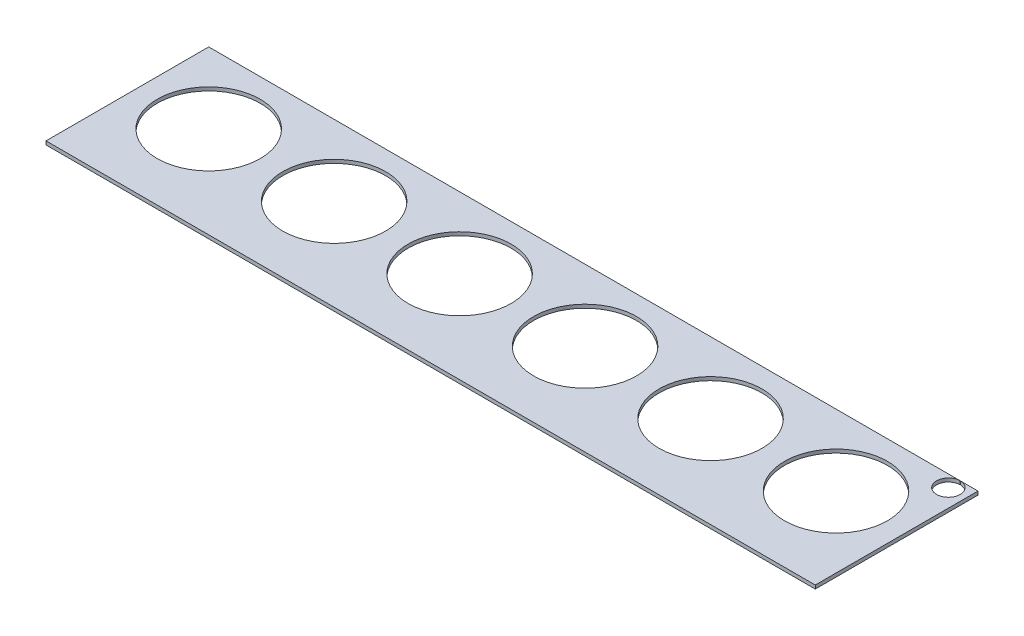
from build123d import *

# Parameters (mm, degrees)
SKETCH1_W           = 650
SKETCH1_H           = 137.5
BOSS_EXTRUDE1_DEPTH = 3
SKETCH2_R           = 43.5
CUT_EXTRUDE1_DEPTH  = 384.084433891
SKETCH2_3_R         = 43.5
SKETCH2_3_R_2       = 10
CUT_EXTRUDE2_DEPTH  = 10


with BuildPart() as part:
    # Sketch1 → Boss-Extrude1 (new body)
    with BuildSketch(Plane(origin=(0, 0, 0), x_dir=(1, 0, 0), z_dir=(0, 1, 0))):
        with Locations((28.149606299, -79.67519685)):
            Rectangle(SKETCH1_W, SKETCH1_H)
    extrude(amount=BOSS_EXTRUDE1_DEPTH)

    # Sketch2 → Cut-Extrude1 (cut, through all)
    with BuildSketch(Plane(origin=(0, 3, 0), x_dir=(1, 0, 0), z_dir=(0, 1, 0))):
        with Locations((-236.850393701, -70.92519685)):
            Circle(SKETCH2_R)
        with Locations((-130.850393701, -70.92519685)):
            Circle(SKETCH2_R)
        with Locations((-24.850393701, -70.92519685)):
            Circle(SKETCH2_R)
        with Locations((81.149606299, -70.92519685)):
            Circle(SKETCH2_R)
        with Locations((187.149606299, -70.92519685)):
            Circle(SKETCH2_R)
        with Locations((293.149606299, -70.92519685)):
            Circle(SKETCH2_R)
    extrude(amount=-CUT_EXTRUDE1_DEPTH, mode=Mode.SUBTRACT)

    # Sketch2<3> → Cut-Extrude2 (cut)
    with BuildSketch(Plane(origin=(0, 3, 0), x_dir=(1, 0, 0), z_dir=(0, 1, 0))):
        with Locations((-236.850393701, -70.92519685)):
            Circle(SKETCH2_3_R)
        with Locations((-130.850393701, -70.92519685)):
            Circle(SKETCH2_3_R)
        with Locations((-24.850393701, -70.92519685)):
            Circle(SKETCH2_3_R)
        with Locations((81.149606299, -70.92519685)):
            Circle(SKETCH2_3_R)
        with Locations((187.149606299, -70.92519685)):
            Circle(SKETCH2_3_R)
        with Locations((293.149606299, -70.92519685)):
            Circle(SKETCH2_3_R)
        with Locations((338.149606299, -20.92419685)):
            Circle(SKETCH2_3_R_2)
    extrude(amount=-CUT_EXTRUDE2_DEPTH, mode=Mode.SUBTRACT)


solid = part.part
